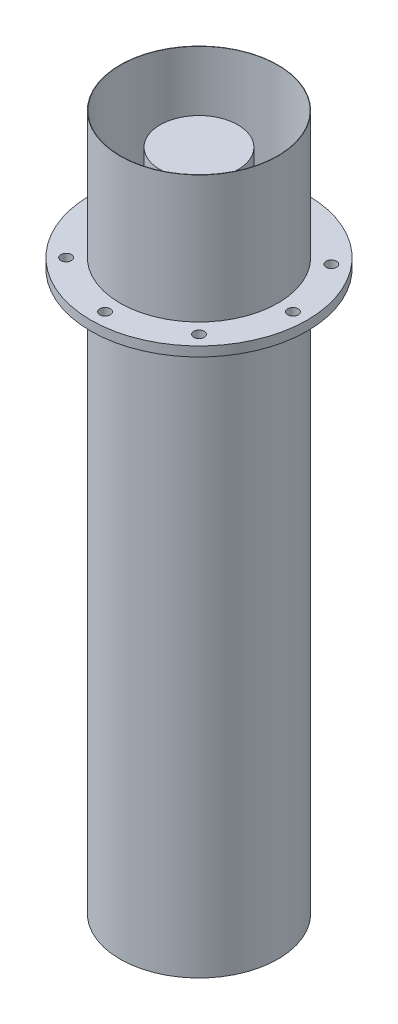
from build123d import *

# Parameters (mm, degrees)
CROQUIS1_R              = 24.8
SALIENTE_EXTRUIR1_DEPTH = 218.4
CORTAR_EXTRUIR1_DEPTH   = 10
CROQUIS3_R              = 12.2
SALIENTE_EXTRUIR2_DEPTH = 30
CORTAR_EXTRUIR2_DEPTH   = 8
CROQUIS5_R              = 24.7
CROQUIS5_R_2            = 22.5
CORTAR_EXTRUIR3_DEPTH   = 300
CROQUIS6_R              = 25.872399076
CORTAR_EXTRUIR4_DEPTH   = 40
CROQUIS7_R              = 30.018047562
CROQUIS7_R_2            = 12.2
CORTAR_EXTRUIR5_DEPTH   = 30
CROQUIS8_R              = 34
CROQUIS8_R_2            = 1.65
CROQUIS8_R_3            = 22.3
SALIENTE_EXTRUIR3_DEPTH = 3


with BuildPart() as part:
    # Croquis1 → Saliente-Extruir1 (new body)
    with BuildSketch(Plane(origin=(0, 0, 0), x_dir=(1, 0, 0), z_dir=(0, 1, 0))):
        with Locations(Location((0, 0, 0), (0, 0, 270))):
            Circle(CROQUIS1_R)
    extrude(amount=SALIENTE_EXTRUIR1_DEPTH)

    # Croquis2 → Cortar-Extruir1 (cut)
    with BuildSketch(Plane.XZ):
        with BuildLine():
            Line((0, 1.5), (1.469693846, 1.5))
            ThreePointArc((1.469693846, 1.5), (0, -2.1), (-1.469693846, 1.5))
            Line((-1.469693846, 1.5), (0, 1.5))
        make_face()
    extrude(amount=-CORTAR_EXTRUIR1_DEPTH, mode=Mode.SUBTRACT)

    # Croquis3 → Saliente-Extruir2 (add)
    with BuildSketch(Plane(origin=(0, 218.4, 0), x_dir=(1, 0, 0), z_dir=(0, 1, 0))):
        with Locations(Location((0, 0, 0), (0, 0, 270))):
            Circle(CROQUIS3_R)
    extrude(amount=SALIENTE_EXTRUIR2_DEPTH)

    # Croquis4 → Cortar-Extruir2 (cut)
    with BuildSketch(Plane.XZ):
        Polygon((3.547480629, 6.218417365), (-3.611567095, 6.181417026), (-7.159047724, -0.037000339), (-3.547480629, -6.218417365), (3.611567095, -6.181417026), (7.159047724, 0.037000339), align=None)
    extrude(amount=-CORTAR_EXTRUIR2_DEPTH, mode=Mode.SUBTRACT)

    # Croquis5 → Cortar-Extruir3 (cut)
    with BuildSketch(Plane(origin=(0, 218.4, 0), x_dir=(1, 0, 0), z_dir=(0, 1, 0))):
        with Locations(Location((0, 0, 0), (0, 0, 270))):
            Circle(CROQUIS5_R)
        with Locations(Location((0, 0, 0), (0, 0, 270))):
            Circle(CROQUIS5_R_2, mode=Mode.SUBTRACT)
    extrude(amount=-CORTAR_EXTRUIR3_DEPTH, mode=Mode.SUBTRACT)


with BuildPart() as cortar_extruir3_piece_1:
    # of the separate pieces the step leaves, piece 1, a body of its own (cortar_extruir3_pieces)
    add(part.part.solids().sort_by_distance((0, 0, 22.5))[0])

    # Croquis6 → Cortar-Extruir4 (cut)
    with BuildSketch(Plane(origin=(0, 248.4, 0), x_dir=(1, 0, 0), z_dir=(0, 1, 0))):
        Circle(CROQUIS6_R)
    extrude(amount=-CORTAR_EXTRUIR4_DEPTH, mode=Mode.SUBTRACT)

    # Croquis7 → Cortar-Extruir5 (cut)
    with BuildSketch(Plane(origin=(0, 208.4, 0), x_dir=(1, 0, 0), z_dir=(0, 1, 0))):
        Circle(CROQUIS7_R)
        with Locations(Location((0, 0, 0), (0, 0, 270))):
            Circle(CROQUIS7_R_2, mode=Mode.SUBTRACT)
    extrude(amount=-CORTAR_EXTRUIR5_DEPTH, mode=Mode.SUBTRACT)

    # Croquis8 → Saliente-Extruir3 (add)
    with BuildSketch(Plane(origin=(0, 178.4, 0), x_dir=(1, 0, 0), z_dir=(0, 1, 0))):
        with Locations(Location((0, 0, 0), (0, 0, 270))):
            Circle(CROQUIS8_R)
        with Locations(Location((-22.598311072, 18.962234486, 0), (0, 0, 270))):
            Circle(CROQUIS8_R_2, mode=Mode.SUBTRACT)
        with Locations(Location((-29.5, 0, 0), (0, 0, 270))):
            Circle(CROQUIS8_R_2, mode=Mode.SUBTRACT)
        with Locations(Location((-20.859650045, -20.859650045, 0), (0, 0, 270))):
            Circle(CROQUIS8_R_2, mode=Mode.SUBTRACT)
        with Locations(Location((0, -29.5, 0), (0, 0, 270))):
            Circle(CROQUIS8_R_2, mode=Mode.SUBTRACT)
        with Locations(Location((20.859650045, -20.859650045, 0), (0, 0, 90))):
            Circle(CROQUIS8_R_2, mode=Mode.SUBTRACT)
        with Locations(Location((22.598311072, 18.962234486, 0), (0, 0, 90))):
            Circle(CROQUIS8_R_2, mode=Mode.SUBTRACT)
        with Locations(Location((29.5, 0, 0), (0, 0, 90))):
            Circle(CROQUIS8_R_2, mode=Mode.SUBTRACT)
        Circle(CROQUIS8_R_3, mode=Mode.SUBTRACT)
    extrude(amount=-SALIENTE_EXTRUIR3_DEPTH)


with BuildPart() as cortar_extruir3_piece_2:
    # of the separate pieces the step leaves, piece 2, a body of its own (cortar_extruir3_pieces)
    add(part.part.solids().sort_by_distance((0, 0, 24.8))[0])


solid = Compound([cortar_extruir3_piece_1.part, cortar_extruir3_piece_2.part])
